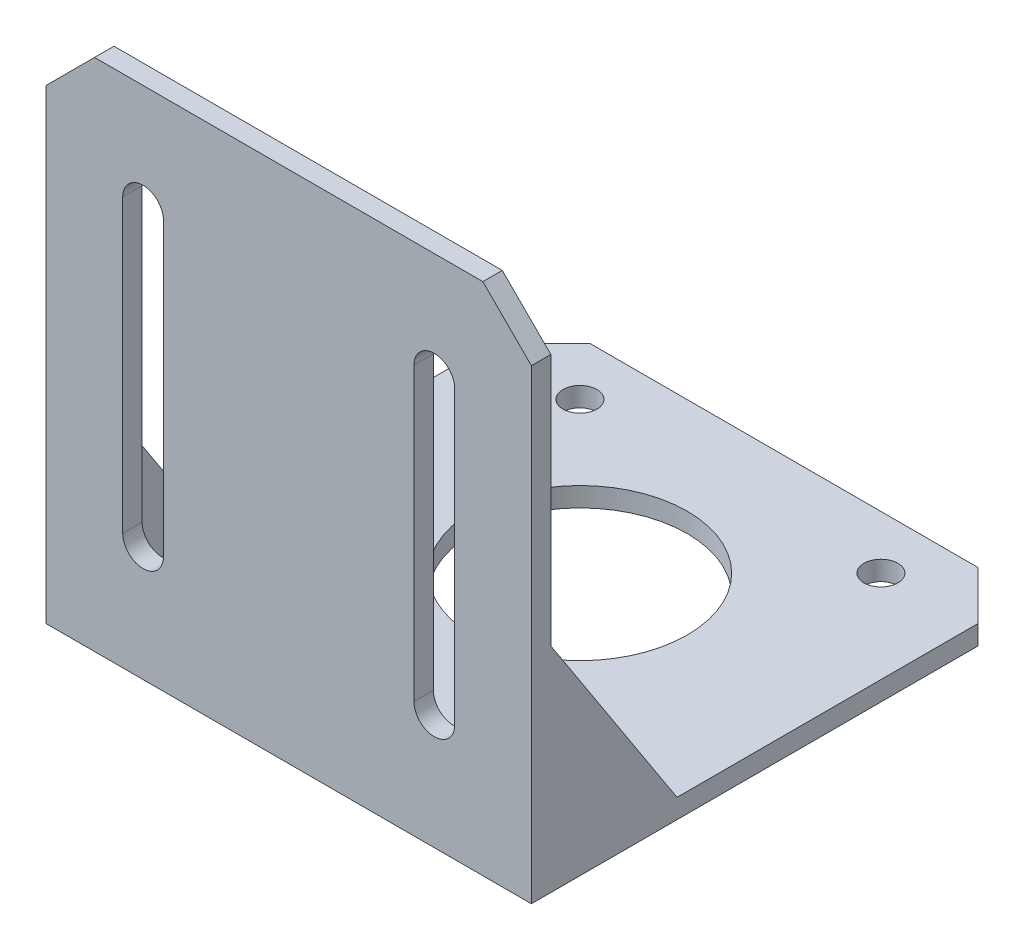
from build123d import *

# Parameters (mm, degrees)
SKETCH_1_W               = 50
SKETCH_1_H               = 49
SKETCH_1_R               = 11.05
SKETCH_1_R_2             = 1.75
EXTRUDE_1_DEPTH          = 2
CHAMFER_1_SIZE           = 5
SKETCH_3_W               = 50
SKETCH_3_H               = 2
EXTRUDE_2_DEPTH          = 53
CHAMFER_2_SIZE           = 5
CHAMFER_3_SIZE           = 5
CUT_EXTRUDE_1_DEPTH      = 77.387171698
CUT_EXTRUDE_1_DEPTH_BACK = 77.387171698
RIB_1_REACH              = 80.797
SKETCH_5_WALL_W          = 183.448137028
SKETCH_5_WALL_H          = 2
FILLET_1_R               = 2


with BuildPart() as part:
    # 草图1 → 凸台-拉伸1 (new body)
    with BuildSketch(Plane(origin=(0, 0, 0), x_dir=(1, 0, 0), z_dir=(0, 1, 0))):
        with Locations((0, -3.5)):
            Rectangle(SKETCH_1_W, SKETCH_1_H)
        with Locations(Location((0, 0, 0), (0, 0, 270))):
            Circle(SKETCH_1_R, mode=Mode.SUBTRACT)
        with Locations(Location((15.5, 15.5, 0), (0, 0, 270))):
            Circle(SKETCH_1_R_2, mode=Mode.SUBTRACT)
        with Locations(Location((15.5, -15.5, 0), (0, 0, 90))):
            Circle(SKETCH_1_R_2, mode=Mode.SUBTRACT)
        with Locations(Location((-15.5, -15.5, 0), (0, 0, 270))):
            Circle(SKETCH_1_R_2, mode=Mode.SUBTRACT)
        with Locations(Location((-15.5, 15.5, 0), (0, 0, 90))):
            Circle(SKETCH_1_R_2, mode=Mode.SUBTRACT)
    extrude(amount=EXTRUDE_1_DEPTH)

    # 倒角1
    chamfer_1_edges = [part.edges().sort_by_distance(p)[0] for p in [
        (-25, 1, -21),
        (25, 1, -21),
    ]]
    chamfer(chamfer_1_edges, length=CHAMFER_1_SIZE)

    # 草图3 → 凸台-拉伸2 (add)
    with BuildSketch(Plane(origin=(0, 0, 0), x_dir=(1, 0, 0), z_dir=(0, 1, 0))):
        with Locations((0, -29)):
            Rectangle(SKETCH_3_W, SKETCH_3_H)
    extrude(amount=EXTRUDE_2_DEPTH)

    # 倒角2
    chamfer_2_edges = [part.edges().sort_by_distance(p)[0] for p in [
        (-25, 53, 29),
    ]]
    chamfer(chamfer_2_edges, length=CHAMFER_2_SIZE)

    # 倒角3
    chamfer_3_edges = [part.edges().sort_by_distance(p)[0] for p in [
        (25, 53, 29),
    ]]
    chamfer(chamfer_3_edges, length=CHAMFER_3_SIZE)

    # 草图4 → 切除-拉伸1 (cut, two sides: drawn at the far end of the back side and taken through both)
    with BuildSketch(Plane(origin=(0, 0, 28), x_dir=(-1, 0, 0), z_dir=(0, 0, -1)).offset(-CUT_EXTRUDE_1_DEPTH_BACK)):
        with BuildLine():
            Line((-17.1, 42), (-17.1, 12))
            ThreePointArc((-17.1, 12), (-15, 9.9), (-12.9, 12))
            Line((-12.9, 12), (-12.9, 42))
            ThreePointArc((-12.9, 42), (-15, 44.1), (-17.1, 42))
        make_face()
        with BuildLine():
            ThreePointArc((17.1, 12), (15, 9.9), (12.9, 12))
            Line((12.9, 12), (12.9, 42))
            ThreePointArc((12.9, 42), (15, 44.1), (17.1, 42))
            Line((17.1, 42), (17.1, 12))
        make_face()
    extrude(amount=CUT_EXTRUDE_1_DEPTH + CUT_EXTRUDE_1_DEPTH_BACK, mode=Mode.SUBTRACT)

    # 草图5 wall → 筋1 (add, up to next)
    with BuildSketch(Plane(origin=(25, 12, 21.5), x_dir=(0, -0.838443616301, -0.544988350595), z_dir=(0, 0.544988350595, -0.838443616301)), mode=Mode.PRIVATE) as rib_1_sk1:
        with Locations((0, 1)):
            Rectangle(SKETCH_5_WALL_W, SKETCH_5_WALL_H)
    rib_1_tool1 = extrude(rib_1_sk1.sketch, amount=-RIB_1_REACH, mode=Mode.PRIVATE) - part.part
    rib_1 = rib_1_tool1.solids().sort_by_distance((25, 12, 21.5))[0]
    add(rib_1)

    # 镜向1: 筋1 across plane
    add(rib_1.mirror(Plane(origin=(0, 0, 0), x_dir=(0, 0, 1), z_dir=(1, 0, 0))))

    # 圆角1
    fillet_1_edges = [part.edges().sort_by_distance(p)[0] for p in [
        (0, 2, 28),
    ]]
    fillet(fillet_1_edges, radius=FILLET_1_R)


solid = part.part
